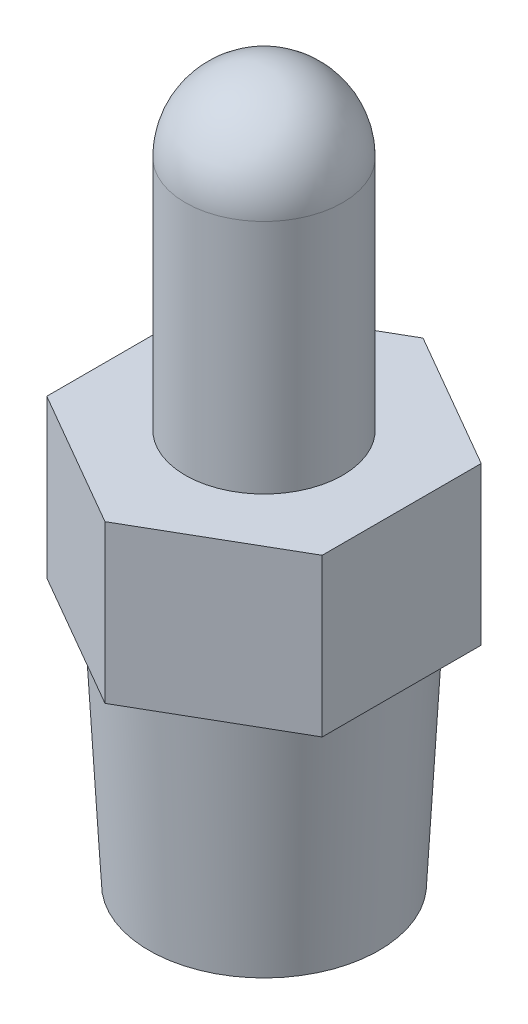
from build123d import *

# Parameters (mm, degrees)
BOSS_EXTRUDE1_DEPTH = 6.35
SKETCH3_R           = 3.175
BOSS_EXTRUDE2_DEPTH = 12.7
FILLET1_R           = 3.175
SKETCH4_R           = 5.136753641
BOSS_EXTRUDE3_DEPTH = 9.525
BOSS_EXTRUDE3_TAPER = 3


with BuildPart() as part:
    # Sketch1 → Boss-Extrude1 (new body)
    with BuildSketch(Plane(origin=(0, 0, 0), x_dir=(1, 0, 0), z_dir=(0, 1, 0))):
        Polygon((5.55625, 3.207902433), (0, 6.415804866), (-5.55625, 3.207902433), (-5.55625, -3.207902433), (0, -6.415804866), (5.55625, -3.207902433), align=None)
    extrude(amount=BOSS_EXTRUDE1_DEPTH)

    # Sketch3 → Boss-Extrude2 (add)
    with BuildSketch(Plane(origin=(0, 6.35, 0), x_dir=(1, 0, 0), z_dir=(0, 1, 0))):
        with Locations(Location((0, 0, 0), (0, 0, 270))):
            Circle(SKETCH3_R)
    extrude(amount=BOSS_EXTRUDE2_DEPTH)

    # Fillet1
    fillet1_edges = [part.edges().sort_by_distance(p)[0] for p in [
        (0, 19.05, -3.175),
    ]]
    fillet(fillet1_edges, radius=FILLET1_R)

    # Sketch4 → Boss-Extrude3 (add)
    with BuildSketch(Plane.XZ):
        Circle(SKETCH4_R)
    extrude(amount=BOSS_EXTRUDE3_DEPTH, taper=BOSS_EXTRUDE3_TAPER)


solid = part.part
